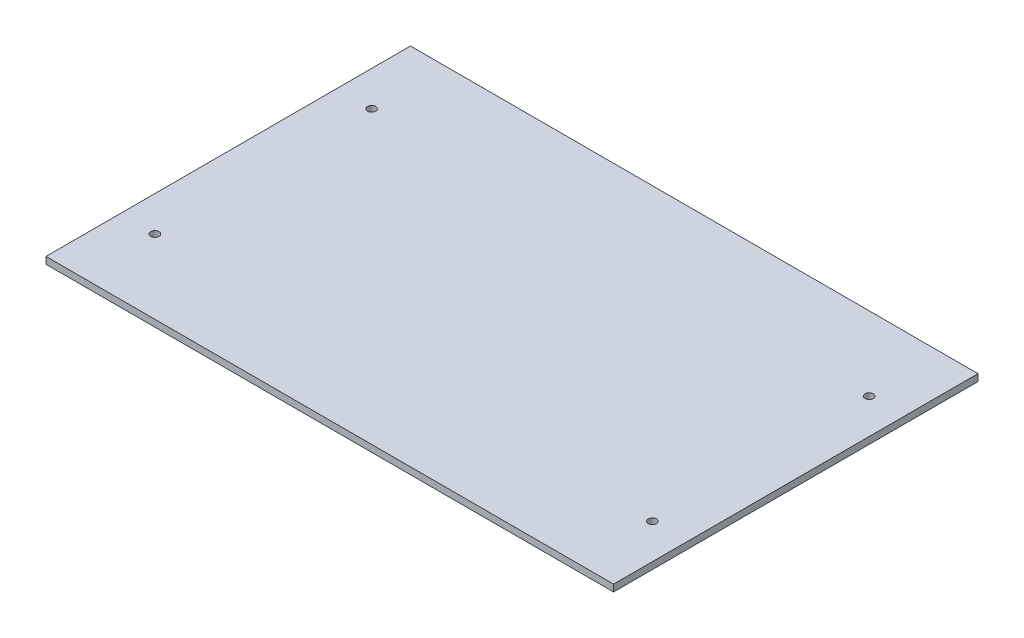
from build123d import *

# Parameters (mm, degrees)
SKETCH1_W           = 463.55
SKETCH1_H           = 297.688
SKETCH1_R           = 3.3782
BOSS_EXTRUDE1_DEPTH = 5.588


with BuildPart() as part:
    # Sketch1 → Boss-Extrude1 (new body)
    with BuildSketch(Plane(origin=(0, 0, 0), x_dir=(1, 0, 0), z_dir=(0, 1, 0))):
        with Locations((231.775, 148.844)):
            Rectangle(SKETCH1_W, SKETCH1_H)
        with Locations(Location((28.575, 60.325, 0), (0, 0, 270))):
            Circle(SKETCH1_R, mode=Mode.SUBTRACT)
        with Locations(Location((28.575, 237.363, 0), (0, 0, 270))):
            Circle(SKETCH1_R, mode=Mode.SUBTRACT)
        with Locations(Location((434.975, 237.363, 0), (0, 0, 90))):
            Circle(SKETCH1_R, mode=Mode.SUBTRACT)
        with Locations(Location((434.975, 60.325, 0), (0, 0, 90))):
            Circle(SKETCH1_R, mode=Mode.SUBTRACT)
    extrude(amount=BOSS_EXTRUDE1_DEPTH)


solid = part.part
